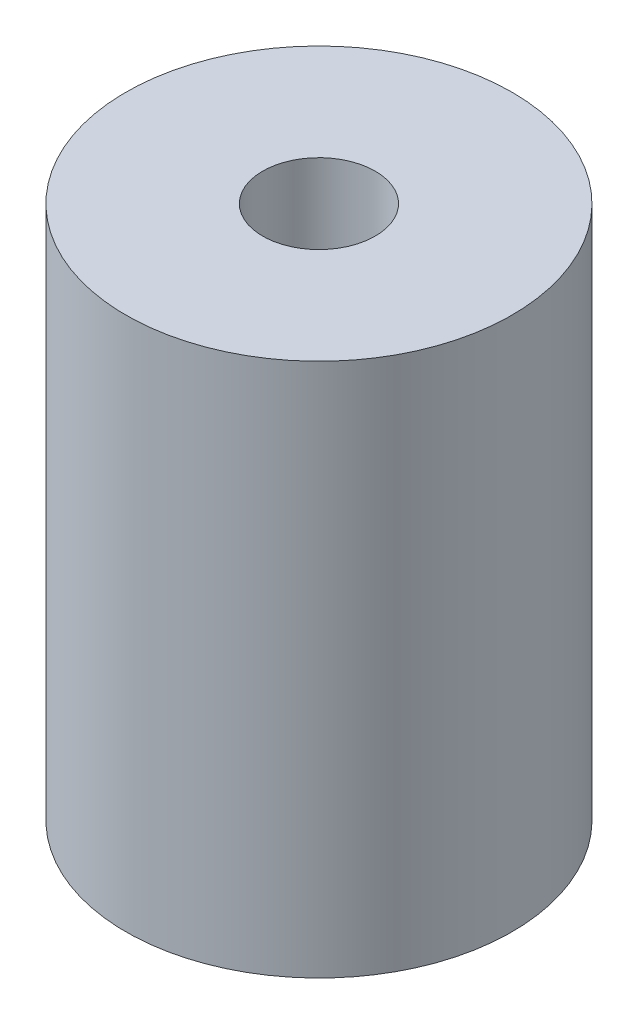
from build123d import *

# Parameters (mm, degrees)
SKETCH1_R           = 6
SKETCH1_R_2         = 1.75
BOSS_EXTRUDE1_DEPTH = 8.3


with BuildPart() as part:
    # Sketch1 → Boss-Extrude1 (new, symmetric)
    with BuildSketch(Plane(origin=(0, 0, 0), x_dir=(1, 0, 0), z_dir=(0, 1, 0))):
        with Locations(Location((0, 0, 0), (0, 0, 90))):
            Circle(SKETCH1_R)
        with Locations(Location((0, 0, 0), (0, 0, 90))):
            Circle(SKETCH1_R_2, mode=Mode.SUBTRACT)
    extrude(amount=BOSS_EXTRUDE1_DEPTH, both=True)


solid = part.part
